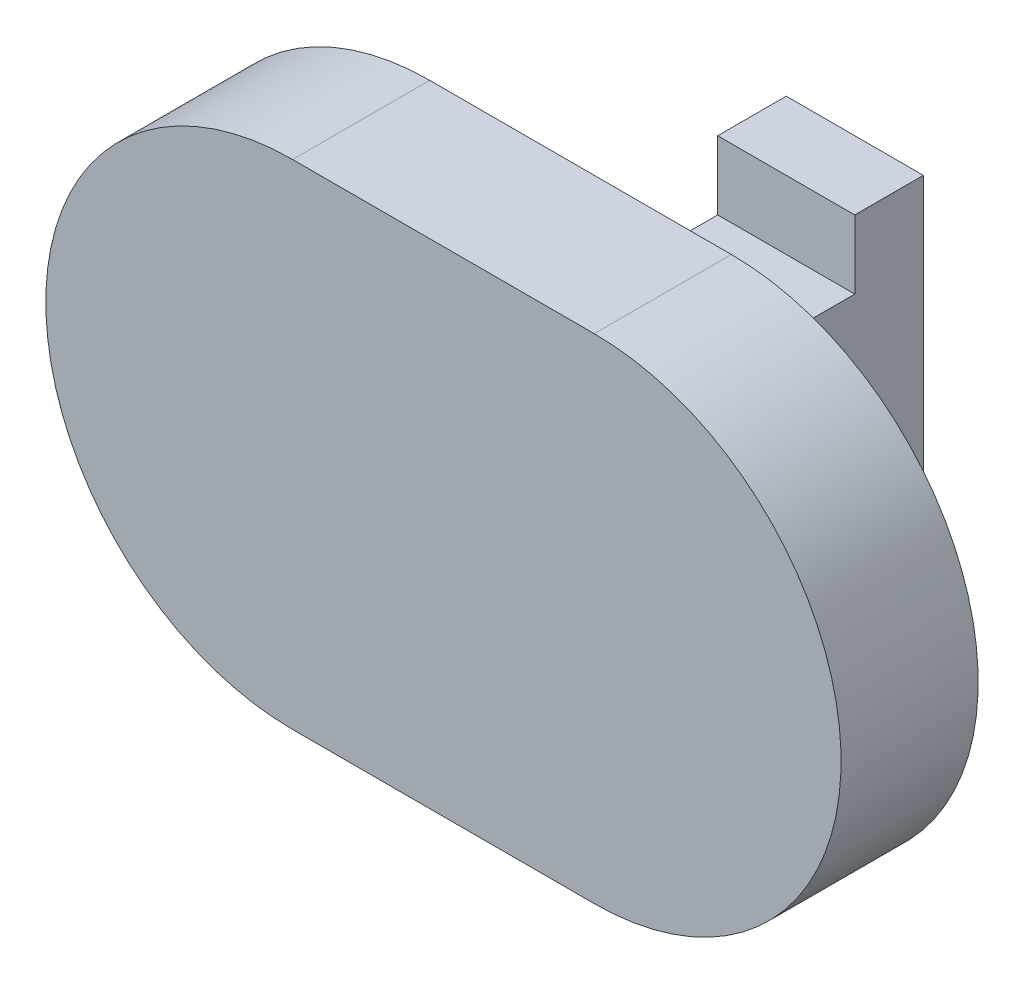
from build123d import *

# Parameters (mm, degrees)
BOSS_EXTRUDE1_DEPTH = 1.27
SKETCH5_W           = 1.27
SKETCH5_H           = 1.27
BOSS_EXTRUDE2_DEPTH = 1.905
SKETCH6_W           = 1.27
SKETCH6_H           = 2.54
BOSS_EXTRUDE3_DEPTH = 0.635


with BuildPart() as part:
    # Sketch3 → Boss-Extrude1 (new body)
    with BuildSketch(Plane.XY):
        with BuildLine():
            Line((-1.397, 2.286), (1.397, 2.286))
            ThreePointArc((1.397, 2.286), (3.683, 0), (1.397, -2.286))
            Line((1.397, -2.286), (-1.397, -2.286))
            ThreePointArc((-1.397, -2.286), (-3.683, 0), (-1.397, 2.286))
        make_face()
    extrude(amount=-BOSS_EXTRUDE1_DEPTH)

    # Sketch5 → Boss-Extrude2 (add)
    with BuildSketch(Plane(origin=(0, 0, -1.27), x_dir=(-1, 0, 0), z_dir=(0, 0, -1))):
        Rectangle(SKETCH5_W, SKETCH5_H)
    extrude(amount=BOSS_EXTRUDE2_DEPTH)

    # Sketch6 → Boss-Extrude3 (add)
    with BuildSketch(Plane(origin=(0, 0, -3.175), x_dir=(-1, 0, 0), z_dir=(0, 0, -1))):
        Rectangle(SKETCH6_W, SKETCH6_H)
    extrude(amount=BOSS_EXTRUDE3_DEPTH)


solid = part.part
